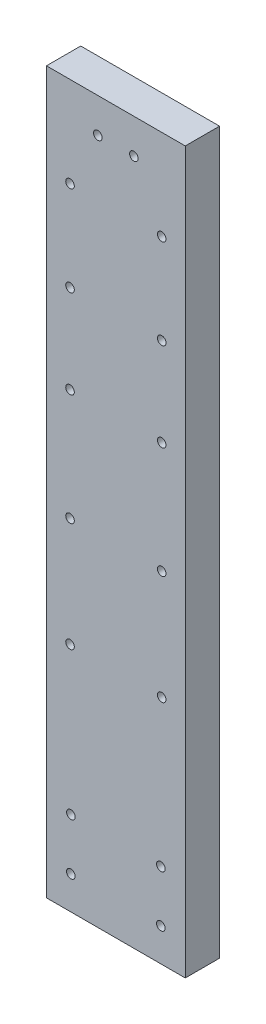
from build123d import *

# Parameters (mm, degrees)
SKETCH1_W           = 16.2
SKETCH1_H           = 84.1
SKETCH1_R           = 0.5
BOSS_EXTRUDE1_DEPTH = 4


with BuildPart() as part:
    # Sketch1 → Boss-Extrude1 (new body)
    with BuildSketch(Plane.XY):
        with Locations((8.1, 42.05)):
            Rectangle(SKETCH1_W, SKETCH1_H)
        with Locations((13.45, 39.74)):
            Circle(SKETCH1_R, mode=Mode.SUBTRACT)
        with Locations((2.75, 63.065)):
            Circle(SKETCH1_R, mode=Mode.SUBTRACT)
        with Locations((13.45, 52.74)):
            Circle(SKETCH1_R, mode=Mode.SUBTRACT)
        with Locations((13.45, 73.565)):
            Circle(SKETCH1_R, mode=Mode.SUBTRACT)
        with Locations((2.75, 27)):
            Circle(SKETCH1_R, mode=Mode.SUBTRACT)
        with Locations((2.75, 73.565)):
            Circle(SKETCH1_R, mode=Mode.SUBTRACT)
        with Locations((2.75, 52.74)):
            Circle(SKETCH1_R, mode=Mode.SUBTRACT)
        with Locations((2.85, 9.846448831)):
            Circle(SKETCH1_R, mode=Mode.SUBTRACT)
        with Locations(Location((13.35, 9.846448831, 0), (0, 0, 180))):
            Circle(SKETCH1_R, mode=Mode.SUBTRACT)
        with Locations(Location((13.35, 3.846448831, 0), (0, 0, 180))):
            Circle(SKETCH1_R, mode=Mode.SUBTRACT)
        with Locations((2.85, 3.846448831)):
            Circle(SKETCH1_R, mode=Mode.SUBTRACT)
        with Locations((6, 80.065)):
            Circle(SKETCH1_R, mode=Mode.SUBTRACT)
        with Locations((13.45, 27)):
            Circle(SKETCH1_R, mode=Mode.SUBTRACT)
        with Locations((13.45, 63.065)):
            Circle(SKETCH1_R, mode=Mode.SUBTRACT)
        with Locations((10.2, 80.065)):
            Circle(SKETCH1_R, mode=Mode.SUBTRACT)
        with Locations((2.75, 39.74)):
            Circle(SKETCH1_R, mode=Mode.SUBTRACT)
    extrude(amount=BOSS_EXTRUDE1_DEPTH)


solid = part.part
